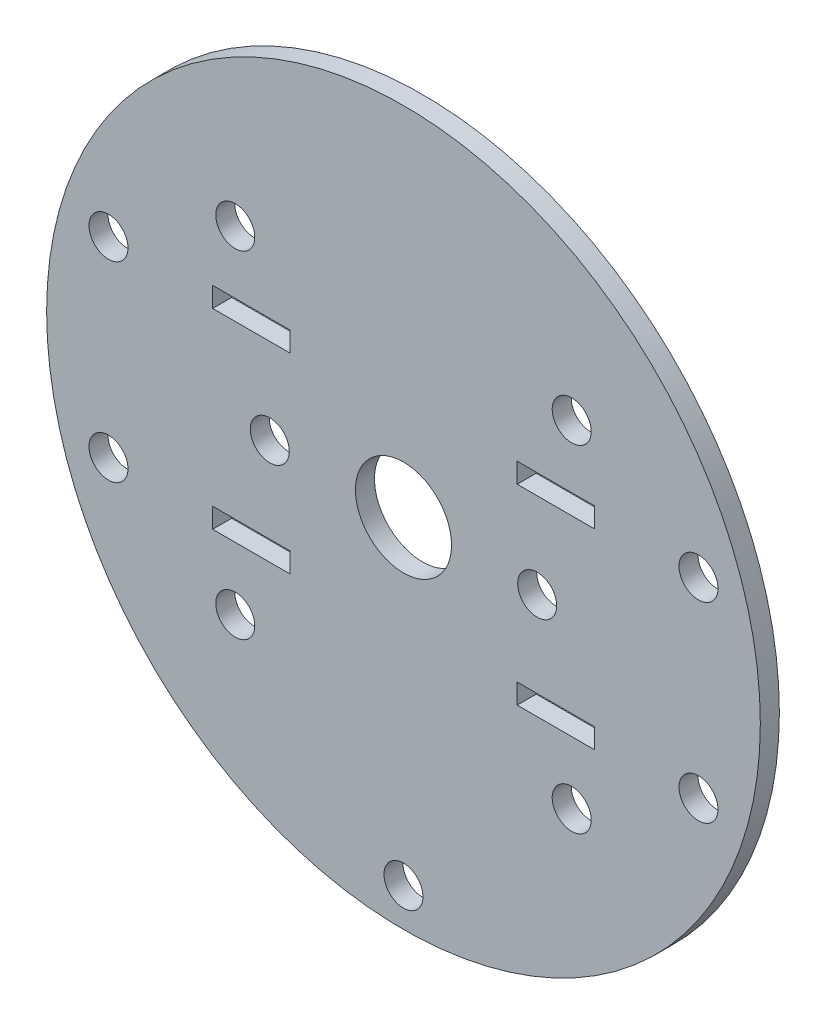
from build123d import *

# Parameters (mm, degrees)
SKETCH_1_R      = 37.5
SKETCH_1_R_2    = 5.05
SKETCH_1_R_3    = 2.05
SKETCH_1_W      = 8.1
SKETCH_1_H      = 2.1
EXTRUDE_1_DEPTH = 2


with BuildPart() as part:
    # 草图1 → 凸台-拉伸1 (new body)
    with BuildSketch(Plane.XY):
        Circle(SKETCH_1_R)
        Circle(SKETCH_1_R_2, mode=Mode.SUBTRACT)
        with Locations((-17.67766953, -17.67766953)):
            Circle(SKETCH_1_R_3, mode=Mode.SUBTRACT)
        with Locations((-17.67766953, 17.67766953)):
            Circle(SKETCH_1_R_3, mode=Mode.SUBTRACT)
        with Locations((17.67766953, 17.67766953)):
            Circle(SKETCH_1_R_3, mode=Mode.SUBTRACT)
        with Locations((17.67766953, -17.67766953)):
            Circle(SKETCH_1_R_3, mode=Mode.SUBTRACT)
        with Locations((-31, -10.05)):
            Circle(SKETCH_1_R_3, mode=Mode.SUBTRACT)
        with Locations(Location((-31, 10.05, 0), (0, 0, 180))):
            Circle(SKETCH_1_R_3, mode=Mode.SUBTRACT)
        with Locations((31, 10.05)):
            Circle(SKETCH_1_R_3, mode=Mode.SUBTRACT)
        with Locations(Location((31, -10.05, 0), (0, 0, 180))):
            Circle(SKETCH_1_R_3, mode=Mode.SUBTRACT)
        with Locations((14.05, 0)):
            Circle(SKETCH_1_R_3, mode=Mode.SUBTRACT)
        with Locations((-14.05, 0)):
            Circle(SKETCH_1_R_3, mode=Mode.SUBTRACT)
        with Locations((0, -33.5)):
            Circle(SKETCH_1_R_3, mode=Mode.SUBTRACT)
        with Locations((16, -10.05)):
            Rectangle(SKETCH_1_W, SKETCH_1_H, mode=Mode.SUBTRACT)
        with Locations((16, 10.05)):
            Rectangle(SKETCH_1_W, SKETCH_1_H, mode=Mode.SUBTRACT)
        with Locations((-16, 10.05)):
            Rectangle(SKETCH_1_W, SKETCH_1_H, mode=Mode.SUBTRACT)
        with Locations((-16, -10.05)):
            Rectangle(SKETCH_1_W, SKETCH_1_H, mode=Mode.SUBTRACT)
    extrude(amount=EXTRUDE_1_DEPTH)


solid = part.part
